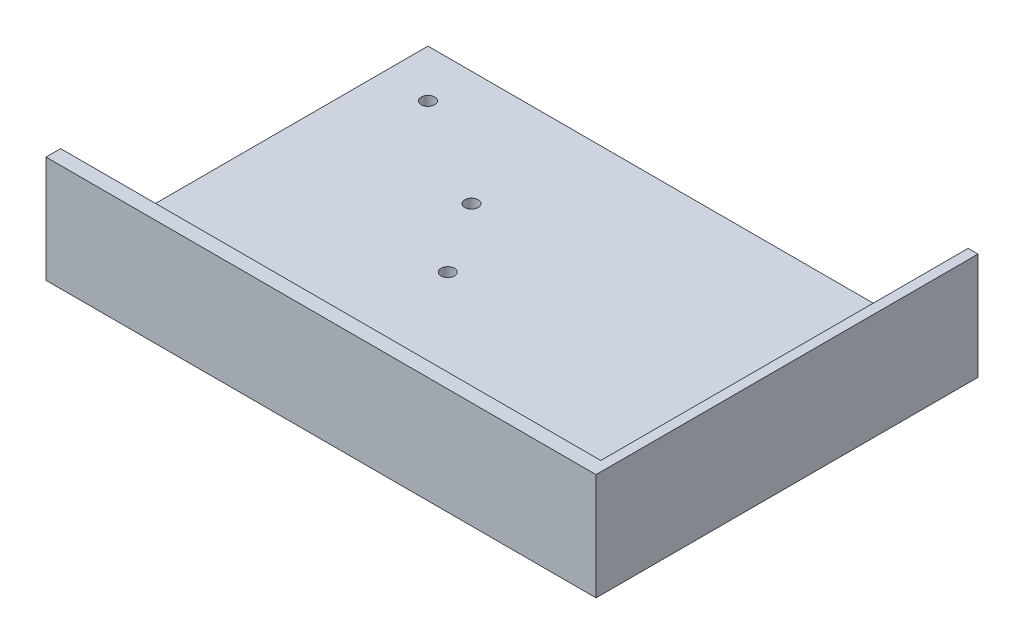
from build123d import *

# Parameters (mm, degrees)
SKETCH1_W                     = 278.2
SKETCH1_H                     = 193.2
SHELL_BLOCK_DEPTH             = 27
SKETCH2_W                     = 273.2
SKETCH2_H                     = 185.8
FRONT_OPENING_DEPTH           = 1.5
SKETCH3_W                     = 273.2
SKETCH3_H                     = 188.2
DISPLAY_POCKET_DEPTH          = 22.5
SKETCH4_W                     = 3
SKETCH4_H                     = 56
VENT_SLOTS_DEPTH              = 4
SKETCH5_W                     = 58
SKETCH5_H                     = 23
CABLE_EXIT_X_SHORT_SIDE_DEPTH = 140.1
SKETCH6_R                     = 1.7
BOLT_HOLES_DEPTH              = 4
KEEP_ONE_HALF_X_DEPTH         = 172.491603293
KEEP_ONE_HALF_X_DEPTH_BACK    = 172.491603293
SKETCH7_W                     = 200
SKETCH7_H                     = 400
KEEP_ONE_QUARTER_Z_DEPTH      = 172.491603293
KEEP_ONE_QUARTER_Z_DEPTH_BACK = 172.491603293
SKETCH8_W                     = 400
SKETCH8_H                     = 200


with BuildPart() as part:
    # Sketch1 → Shell Block (new body)
    with BuildSketch(Plane(origin=(0, 0, 0), x_dir=(1, 0, 0), z_dir=(0, 1, 0))):
        Rectangle(SKETCH1_W, SKETCH1_H)
    extrude(amount=SHELL_BLOCK_DEPTH)

    # Sketch2 → Front Opening (cut)
    with BuildSketch(Plane(origin=(0, 27, 0), x_dir=(1, 0, 0), z_dir=(0, 1, 0))):
        Rectangle(SKETCH2_W, SKETCH2_H)
    extrude(amount=-FRONT_OPENING_DEPTH, mode=Mode.SUBTRACT)

    # Sketch3 → Display Pocket (cut)
    with BuildSketch(Plane(origin=(0, 25.5, 0), x_dir=(1, 0, 0), z_dir=(0, 1, 0))):
        Rectangle(SKETCH3_W, SKETCH3_H)
    extrude(amount=-DISPLAY_POCKET_DEPTH, mode=Mode.SUBTRACT)

    # Sketch4 → Vent Slots (cut)
    with BuildSketch(Plane(origin=(0, 3, 0), x_dir=(1, 0, 0), z_dir=(0, 1, 0))):
        with Locations((-67.5, 56)):
            Rectangle(SKETCH4_W, SKETCH4_H)
        with Locations((-67.5, -56)):
            Rectangle(SKETCH4_W, SKETCH4_H)
        with Locations((-75.5, 56)):
            Rectangle(SKETCH4_W, SKETCH4_H)
        with Locations((-75.5, -56)):
            Rectangle(SKETCH4_W, SKETCH4_H)
        with Locations((-83.5, 56)):
            Rectangle(SKETCH4_W, SKETCH4_H)
        with Locations((-83.5, -56)):
            Rectangle(SKETCH4_W, SKETCH4_H)
        with Locations((-91.5, 56)):
            Rectangle(SKETCH4_W, SKETCH4_H)
        with Locations((-91.5, -56)):
            Rectangle(SKETCH4_W, SKETCH4_H)
        with Locations((-99.5, 56)):
            Rectangle(SKETCH4_W, SKETCH4_H)
        with Locations((-99.5, -56)):
            Rectangle(SKETCH4_W, SKETCH4_H)
        with Locations((-107.5, 56)):
            Rectangle(SKETCH4_W, SKETCH4_H)
        with Locations((-107.5, -56)):
            Rectangle(SKETCH4_W, SKETCH4_H)
        with Locations((-115.5, 56)):
            Rectangle(SKETCH4_W, SKETCH4_H)
        with Locations((-115.5, -56)):
            Rectangle(SKETCH4_W, SKETCH4_H)
        with Locations((-123.5, 56)):
            Rectangle(SKETCH4_W, SKETCH4_H)
        with Locations((-123.5, -56)):
            Rectangle(SKETCH4_W, SKETCH4_H)
    extrude(amount=-VENT_SLOTS_DEPTH, mode=Mode.SUBTRACT)

    # Sketch5 → Cable Exit (-X short side) (cut)
    with BuildSketch(Plane(origin=(0, 0, 0), x_dir=(0, 0, -1), z_dir=(1, 0, 0))):
        with Locations((0, 16.5)):
            Rectangle(SKETCH5_W, SKETCH5_H)
    extrude(amount=-CABLE_EXIT_X_SHORT_SIDE_DEPTH, mode=Mode.SUBTRACT)

    # Sketch6 → Bolt Holes (cut)
    with BuildSketch(Plane(origin=(0, 3, 0), x_dir=(1, 0, 0), z_dir=(0, 1, 0))):
        with Locations(Location((-40, -29, 0), (0, 0, 270))):
            Circle(SKETCH6_R)
        with Locations(Location((-40, -89, 0), (0, 0, 270))):
            Circle(SKETCH6_R)
        with Locations(Location((40, -29, 0), (0, 0, 270))):
            Circle(SKETCH6_R)
        with Locations(Location((40, -89, 0), (0, 0, 270))):
            Circle(SKETCH6_R)
        with Locations(Location((-52, -47, 0), (0, 0, 270))):
            Circle(SKETCH6_R)
        with Locations(Location((-52, -71, 0), (0, 0, 270))):
            Circle(SKETCH6_R)
        with Locations(Location((52, -47, 0), (0, 0, 270))):
            Circle(SKETCH6_R)
        with Locations(Location((52, -71, 0), (0, 0, 270))):
            Circle(SKETCH6_R)
        with Locations(Location((-12, 82, 0), (0, 0, 270))):
            Circle(SKETCH6_R)
        with Locations(Location((12, 82, 0), (0, 0, 270))):
            Circle(SKETCH6_R)
        with Locations(Location((124, 12, 0), (0, 0, 270))):
            Circle(SKETCH6_R)
        with Locations(Location((124, -12, 0), (0, 0, 270))):
            Circle(SKETCH6_R)
        with Locations(Location((-12, 12, 0), (0, 0, 270))):
            Circle(SKETCH6_R)
        with Locations(Location((-12, -12, 0), (0, 0, 270))):
            Circle(SKETCH6_R)
        with Locations(Location((12, 12, 0), (0, 0, 270))):
            Circle(SKETCH6_R)
        with Locations(Location((12, -12, 0), (0, 0, 270))):
            Circle(SKETCH6_R)
        with Locations(Location((-110, -12, 0), (0, 0, 270))):
            Circle(SKETCH6_R)
        with Locations(Location((-110, 12, 0), (0, 0, 270))):
            Circle(SKETCH6_R)
        with Locations(Location((-86, -12, 0), (0, 0, 270))):
            Circle(SKETCH6_R)
        with Locations(Location((-86, 12, 0), (0, 0, 270))):
            Circle(SKETCH6_R)
    extrude(amount=-BOLT_HOLES_DEPTH, mode=Mode.SUBTRACT)

    # Sketch7 → Keep one half (X) (cut, two sides: drawn at the far end of the back side and taken through both)
    with BuildSketch(Plane(origin=(0, 0, 0), x_dir=(1, 0, 0), z_dir=(0, 1, 0)).offset(-KEEP_ONE_HALF_X_DEPTH_BACK)):
        with Locations((-100, 0)):
            Rectangle(SKETCH7_W, SKETCH7_H)
    extrude(amount=KEEP_ONE_HALF_X_DEPTH + KEEP_ONE_HALF_X_DEPTH_BACK, mode=Mode.SUBTRACT)

    # Sketch8 → Keep one quarter (Z) (cut, two sides: drawn at the far end of the back side and taken through both)
    with BuildSketch(Plane(origin=(0, 0, 0), x_dir=(1, 0, 0), z_dir=(0, 1, 0)).offset(-KEEP_ONE_QUARTER_Z_DEPTH_BACK)):
        with Locations((0, 100)):
            Rectangle(SKETCH8_W, SKETCH8_H)
    extrude(amount=KEEP_ONE_QUARTER_Z_DEPTH + KEEP_ONE_QUARTER_Z_DEPTH_BACK, mode=Mode.SUBTRACT)


solid = part.part
